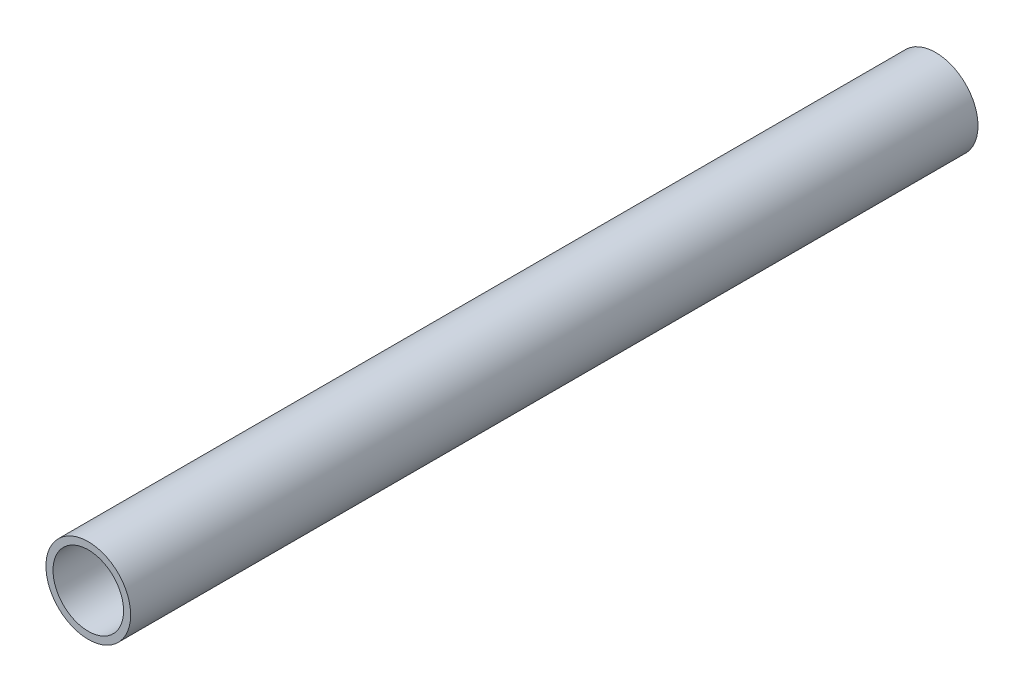
from build123d import *

# Parameters (mm, degrees)
SKETCH1_R           = 15
SKETCH1_R_2         = 12.5
BOSS_EXTRUDE1_DEPTH = 300


with BuildPart() as part:
    # Sketch1 → Boss-Extrude1 (new body)
    with BuildSketch(Plane.XY):
        Circle(SKETCH1_R)
        Circle(SKETCH1_R_2, mode=Mode.SUBTRACT)
    extrude(amount=BOSS_EXTRUDE1_DEPTH)


solid = part.part
